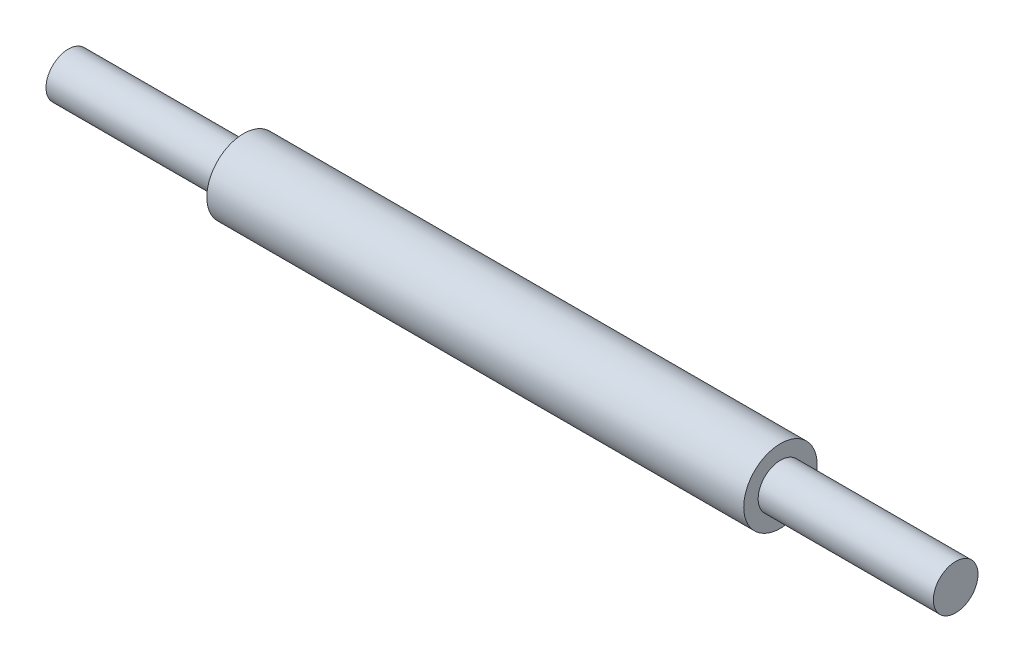
from build123d import *

# Parameters (mm, degrees)
SKETCH1_R           = 3.95
BOSS_EXTRUDE1_DEPTH = 31
SKETCH2_R           = 6.5
BOSS_EXTRUDE2_DEPTH = 95
BOSS_EXTRUDE3_START = 31
SKETCH3_R           = 3.95
BOSS_EXTRUDE3_DEPTH = 31


with BuildPart() as part:
    # Sketch1 → Boss-Extrude1 (new body)
    with BuildSketch(Plane(origin=(0, 0, 0), x_dir=(0, 0, -1), z_dir=(1, 0, 0))):
        Circle(SKETCH1_R)
    extrude(amount=BOSS_EXTRUDE1_DEPTH)

    # Sketch2 → Boss-Extrude2 (add)
    with BuildSketch(Plane.ZY):
        Circle(SKETCH2_R)
    extrude(amount=BOSS_EXTRUDE2_DEPTH)

    # Sketch3 → Boss-Extrude3 (add)
    with BuildSketch(Plane.ZY.offset(95).offset(BOSS_EXTRUDE3_START)):
        Circle(SKETCH3_R)
    extrude(amount=-BOSS_EXTRUDE3_DEPTH)


solid = part.part
